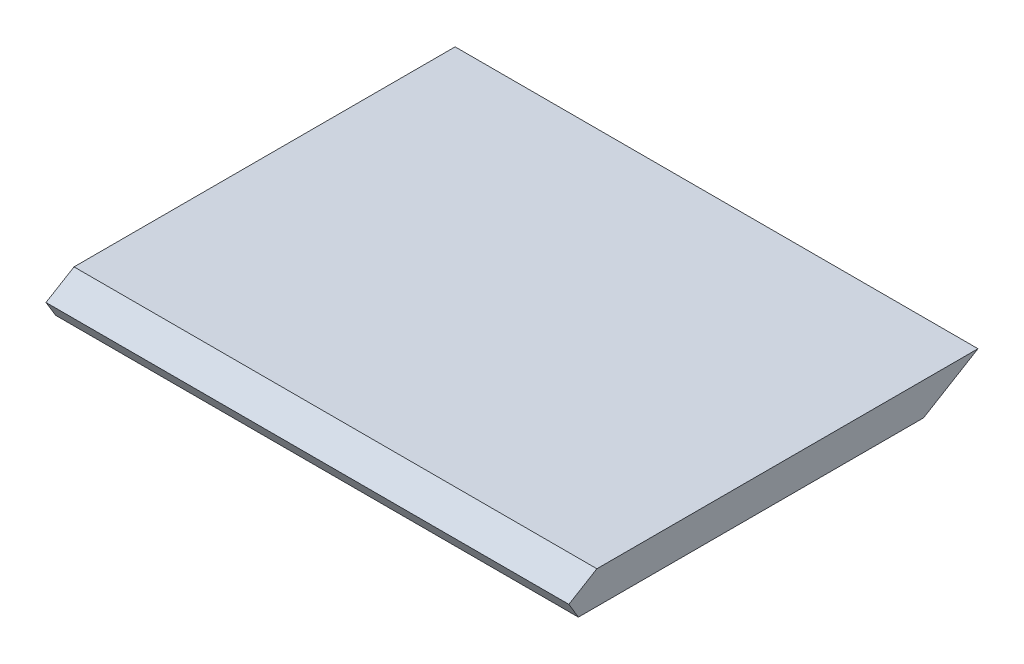
from build123d import *

# Parameters (mm, degrees)
BOSS_EXTRUDE2_DEPTH = 101.6


with BuildPart() as part:
    # Sketch3 → Boss-Extrude2 (new body)
    with BuildSketch(Plane(origin=(71.193282606, 0, 0), x_dir=(0, 0, -1), z_dir=(1, 0, 0))):
        Polygon((56.967958628, 6.35), (46.384625295, 0), (-20.680439343, 0), (-22.530210515, 3.082951953), (-17.085130436, 6.35), align=None)
    extrude(amount=-BOSS_EXTRUDE2_DEPTH)


solid = part.part
